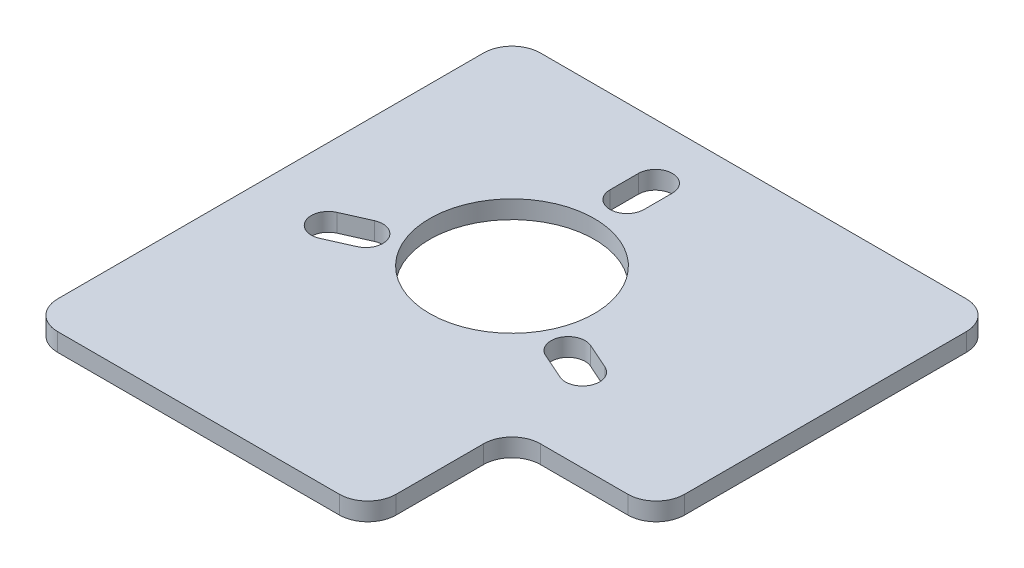
from build123d import *

# Parameters (mm, degrees)
SKETCH1_W           = 170
SKETCH1_H           = 170
SKETCH1_R           = 29
BOSS_EXTRUDE1_DEPTH = 6.35
SKETCH2_W           = 50.8
SKETCH2_H           = 50.8
CUT_EXTRUDE1_DEPTH  = 241.500150728
FILLET1_R           = 10
CUT_EXTRUDE2_DEPTH  = 241.500150728


with BuildPart() as part:
    # Sketch1 → Boss-Extrude1 (new body)
    with BuildSketch(Plane(origin=(0, 0, 0), x_dir=(1, 0, 0), z_dir=(0, 1, 0))):
        with Locations((85, 85)):
            Rectangle(SKETCH1_W, SKETCH1_H)
        with Locations(Location((70, 100, 0), (0, 0, 270))):
            Circle(SKETCH1_R, mode=Mode.SUBTRACT)
    extrude(amount=BOSS_EXTRUDE1_DEPTH)

    # Sketch2 → Cut-Extrude1 (cut, through all)
    with BuildSketch(Plane(origin=(0, 6.35, 0), x_dir=(1, 0, 0), z_dir=(0, 1, 0))):
        with Locations((144.6, 25.4)):
            Rectangle(SKETCH2_W, SKETCH2_H)
    extrude(amount=-CUT_EXTRUDE1_DEPTH, mode=Mode.SUBTRACT)

    # Fillet1
    fillet1_edges = [part.edges().sort_by_distance(p)[0] for p in [
        (119.2, 3.175, 0),
        (119.2, 3.175, -50.8),
        (170, 3.175, -50.8),
        (0, 3.175, -170),
        (170, 3.175, -170),
        (0, 3.175, 0),
    ]]
    fillet(fillet1_edges, radius=FILLET1_R)

    # Sketch3 → Cut-Extrude2 (cut, through all)
    with BuildSketch(Plane(origin=(0, 6.35, 0), x_dir=(1, 0, 0), z_dir=(0, 1, 0))):
        with BuildLine():
            Line((22.795852717, 85.551177235), (31.931307293, 89.618543666))
            ThreePointArc((31.931307293, 89.618543666), (39.852999898, 86.577690778), (36.81214701, 78.655998174))
            Line((36.81214701, 78.655998174), (27.676692434, 74.588631743))
            ThreePointArc((27.676692434, 74.588631743), (19.75499983, 77.629484631), (22.795852717, 85.551177235))
        make_face()
        with BuildLine():
            Line((112.323307566, 74.588631743), (103.18785299, 78.655998174))
            ThreePointArc((103.18785299, 78.655998174), (100.147000102, 86.577690778), (108.068692707, 89.618543666))
            Line((108.068692707, 89.618543666), (117.204147283, 85.551177235))
            ThreePointArc((117.204147283, 85.551177235), (120.24500017, 77.629484631), (112.323307566, 74.588631743))
        make_face()
        with BuildLine():
            Line((76, 150.5), (76, 140.5))
            ThreePointArc((76, 140.5), (70, 134.5), (64, 140.5))
            Line((64, 140.5), (64, 150.5))
            ThreePointArc((64, 150.5), (70, 156.5), (76, 150.5))
        make_face()
    extrude(amount=-CUT_EXTRUDE2_DEPTH, mode=Mode.SUBTRACT)


solid = part.part
